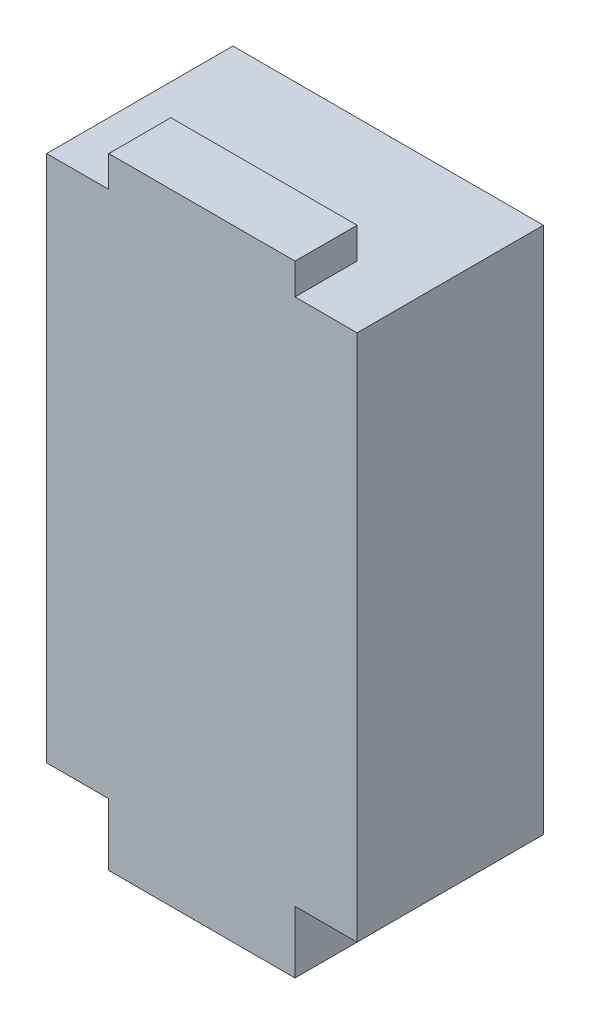
from build123d import *

# Parameters (mm, degrees)
BOSS_EXTRUDE1_DEPTH = 10
SKETCH2_W           = 50
SKETCH2_H           = 85
BOSS_EXTRUDE2_DEPTH = 20
SKETCH3_R           = 6
CUT_EXTRUDE1_DEPTH  = 20


with BuildPart() as part:
    # Sketch1 → Boss-Extrude1 (new body)
    with BuildSketch(Plane.XY):
        Polygon((-10, 0), (-40, 0), (-40, 10), (-50, 10), (-50, 95), (-40, 95), (-40, 100), (-10, 100), (-10, 95), (0, 95), (0, 10), (-10, 10), align=None)
    extrude(amount=BOSS_EXTRUDE1_DEPTH)

    # Sketch2 → Boss-Extrude2 (add)
    with BuildSketch(Plane(origin=(0, 0, 0), x_dir=(-1, 0, 0), z_dir=(0, 0, -1))):
        with Locations((25, 52.5)):
            Rectangle(SKETCH2_W, SKETCH2_H)
    extrude(amount=BOSS_EXTRUDE2_DEPTH)

    # Sketch3 → Cut-Extrude1 (cut)
    with BuildSketch(Plane(origin=(0, 0, -20), x_dir=(-1, 0, 0), z_dir=(0, 0, -1))):
        with Locations((25, 35)):
            Circle(SKETCH3_R)
    extrude(amount=-CUT_EXTRUDE1_DEPTH, mode=Mode.SUBTRACT)


solid = part.part
